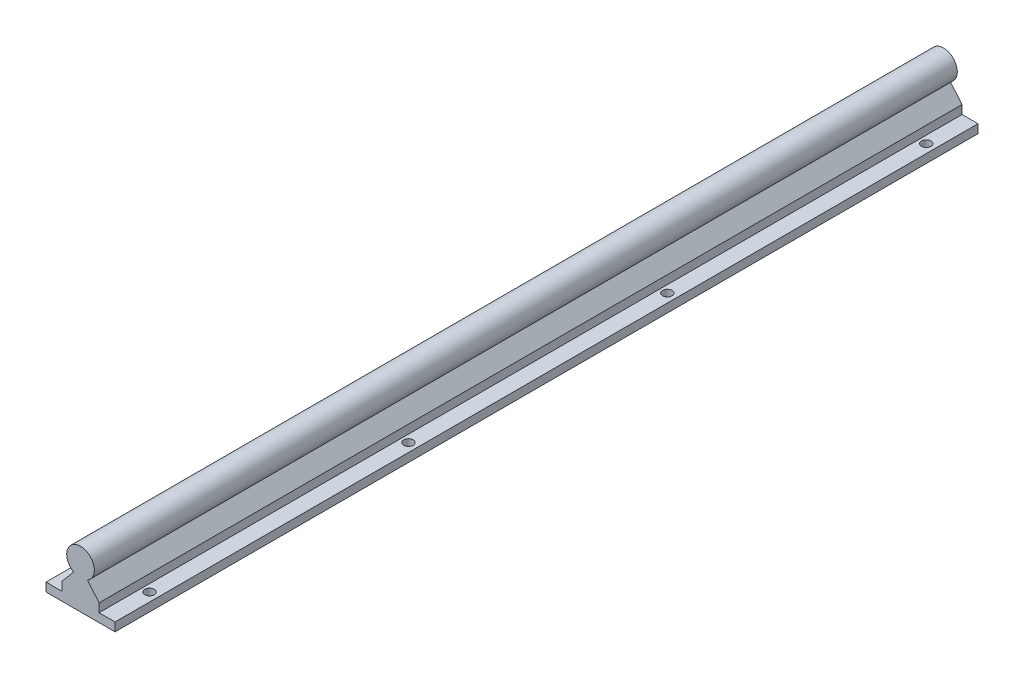
from build123d import *

# Parameters (mm, degrees)
BOSS_EXTRUDE1_DEPTH = 500
SKETCH2_R           = 2.75
CUT_EXTRUDE1_DEPTH  = 502.554026994


with BuildPart() as part:
    # Sketch1 → Boss-Extrude1 (new body)
    with BuildSketch(Plane.XY):
        with BuildLine():
            Line((-21.620406895, 0), (18.379593105, 0))
            Line((18.379593105, 0), (18.379593105, 5))
            Line((18.379593105, 5), (9.152634797, 5))
            Line((9.152634797, 5), (9.152634797, 10))
            Line((9.152634797, 10), (2.379593105, 18.07179677))
            ThreePointArc((2.379593105, 18.07179677), (-1.620406895, 33), (-5.620406895, 18.07179677))
            Line((-5.620406895, 18.07179677), (-12.393448588, 10))
            Line((-12.393448588, 10), (-12.393448588, 5))
            Line((-12.393448588, 5), (-21.620406895, 5))
            Line((-21.620406895, 5), (-21.620406895, 0))
        make_face()
    extrude(amount=BOSS_EXTRUDE1_DEPTH)

    # Sketch2 → Cut-Extrude1 (cut, through all)
    with BuildSketch(Plane(origin=(0, 0, 0), x_dir=(1, 0, 0), z_dir=(0, 1, 0))):
        with Locations(Location((-16.620406895, -475, 0), (0, 0, 90))):
            Circle(SKETCH2_R)
        with Locations(Location((13.379593105, -475, 0), (0, 0, 90))):
            Circle(SKETCH2_R)
        with Locations(Location((-16.620406895, -325, 0), (0, 0, 90))):
            Circle(SKETCH2_R)
        with Locations(Location((13.379593105, -325, 0), (0, 0, 90))):
            Circle(SKETCH2_R)
        with Locations(Location((-16.620406895, -175, 0), (0, 0, 90))):
            Circle(SKETCH2_R)
        with Locations(Location((13.379593105, -175, 0), (0, 0, 90))):
            Circle(SKETCH2_R)
        with Locations(Location((-16.620406895, -25, 0), (0, 0, 90))):
            Circle(SKETCH2_R)
        with Locations(Location((13.379593105, -25, 0), (0, 0, 90))):
            Circle(SKETCH2_R)
    extrude(amount=CUT_EXTRUDE1_DEPTH, mode=Mode.SUBTRACT)


solid = part.part
